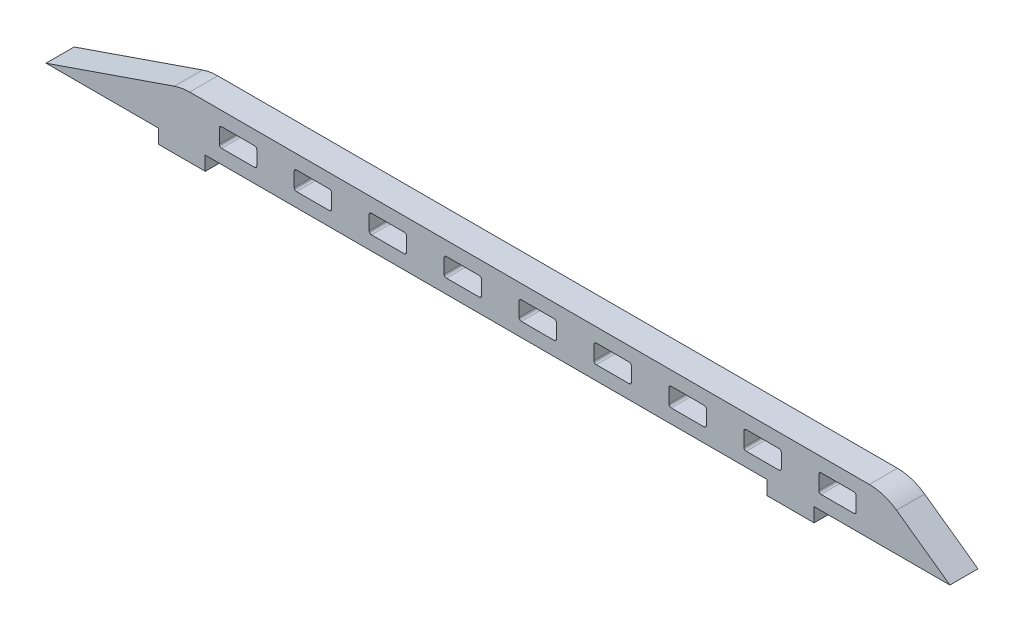
from build123d import *

# Parameters (mm, degrees)
BOSS_EXTRUDE1_DEPTH = 6
FILLET1_R           = 10


with BuildPart() as part:
    # Sketch1 → Boss-Extrude1 (new body)
    with BuildSketch(Plane.XY):
        Polygon((0, 0), (24, 0), (24, -3), (34, -3), (34, 0), (154, 0), (154, -3), (164, -3), (164, 0), (193, 0), (179, 10), (29, 10), align=None)
        with BuildLine():
            Line((53.5, 7), (60.5, 7))
            ThreePointArc((60.5, 7), (60.853553391, 6.853553391), (61, 6.5))
            Line((61, 6.5), (61, 3.5))
            ThreePointArc((61, 3.5), (60.853553391, 3.146446609), (60.5, 3))
            Line((60.5, 3), (53.5, 3))
            ThreePointArc((53.5, 3), (53.146446609, 3.146446609), (53, 3.5))
            Line((53, 3.5), (53, 6.5))
            ThreePointArc((53, 6.5), (53.146446609, 6.853553391), (53.5, 7))
        make_face(mode=Mode.SUBTRACT)
        with BuildLine():
            Line((37.5, 7), (44.5, 7))
            ThreePointArc((44.5, 7), (44.853553391, 6.853553391), (45, 6.5))
            Line((45, 6.5), (45, 3.5))
            ThreePointArc((45, 3.5), (44.853553391, 3.146446609), (44.5, 3))
            Line((44.5, 3), (37.5, 3))
            ThreePointArc((37.5, 3), (37.146446609, 3.146446609), (37, 3.5))
            Line((37, 3.5), (37, 6.5))
            ThreePointArc((37, 6.5), (37.146446609, 6.853553391), (37.5, 7))
        make_face(mode=Mode.SUBTRACT)
        with BuildLine():
            Line((69.5, 7), (76.5, 7))
            ThreePointArc((76.5, 7), (76.853553391, 6.853553391), (77, 6.5))
            Line((77, 6.5), (77, 3.5))
            ThreePointArc((77, 3.5), (76.853553391, 3.146446609), (76.5, 3))
            Line((76.5, 3), (69.5, 3))
            ThreePointArc((69.5, 3), (69.146446609, 3.146446609), (69, 3.5))
            Line((69, 3.5), (69, 6.5))
            ThreePointArc((69, 6.5), (69.146446609, 6.853553391), (69.5, 7))
        make_face(mode=Mode.SUBTRACT)
        with BuildLine():
            Line((85.5, 7), (92.5, 7))
            ThreePointArc((92.5, 7), (92.853553391, 6.853553391), (93, 6.5))
            Line((93, 6.5), (93, 3.5))
            ThreePointArc((93, 3.5), (92.853553391, 3.146446609), (92.5, 3))
            Line((92.5, 3), (85.5, 3))
            ThreePointArc((85.5, 3), (85.146446609, 3.146446609), (85, 3.5))
            Line((85, 3.5), (85, 6.5))
            ThreePointArc((85, 6.5), (85.146446609, 6.853553391), (85.5, 7))
        make_face(mode=Mode.SUBTRACT)
        with BuildLine():
            Line((101.5, 7), (108.5, 7))
            ThreePointArc((108.5, 7), (108.853553391, 6.853553391), (109, 6.5))
            Line((109, 6.5), (109, 3.5))
            ThreePointArc((109, 3.5), (108.853553391, 3.146446609), (108.5, 3))
            Line((108.5, 3), (101.5, 3))
            ThreePointArc((101.5, 3), (101.146446609, 3.146446609), (101, 3.5))
            Line((101, 3.5), (101, 6.5))
            ThreePointArc((101, 6.5), (101.146446609, 6.853553391), (101.5, 7))
        make_face(mode=Mode.SUBTRACT)
        with BuildLine():
            Line((117.5, 7), (124.5, 7))
            ThreePointArc((124.5, 7), (124.853553391, 6.853553391), (125, 6.5))
            Line((125, 6.5), (125, 3.5))
            ThreePointArc((125, 3.5), (124.853553391, 3.146446609), (124.5, 3))
            Line((124.5, 3), (117.5, 3))
            ThreePointArc((117.5, 3), (117.146446609, 3.146446609), (117, 3.5))
            Line((117, 3.5), (117, 6.5))
            ThreePointArc((117, 6.5), (117.146446609, 6.853553391), (117.5, 7))
        make_face(mode=Mode.SUBTRACT)
        with BuildLine():
            Line((133.5, 7), (140.5, 7))
            ThreePointArc((140.5, 7), (140.853553391, 6.853553391), (141, 6.5))
            Line((141, 6.5), (141, 3.5))
            ThreePointArc((141, 3.5), (140.853553391, 3.146446609), (140.5, 3))
            Line((140.5, 3), (133.5, 3))
            ThreePointArc((133.5, 3), (133.146446609, 3.146446609), (133, 3.5))
            Line((133, 3.5), (133, 6.5))
            ThreePointArc((133, 6.5), (133.146446609, 6.853553391), (133.5, 7))
        make_face(mode=Mode.SUBTRACT)
        with BuildLine():
            Line((149.5, 7), (156.5, 7))
            ThreePointArc((156.5, 7), (156.853553391, 6.853553391), (157, 6.5))
            Line((157, 6.5), (157, 3.5))
            ThreePointArc((157, 3.5), (156.853553391, 3.146446609), (156.5, 3))
            Line((156.5, 3), (149.5, 3))
            ThreePointArc((149.5, 3), (149.146446609, 3.146446609), (149, 3.5))
            Line((149, 3.5), (149, 6.5))
            ThreePointArc((149, 6.5), (149.146446609, 6.853553391), (149.5, 7))
        make_face(mode=Mode.SUBTRACT)
        with BuildLine():
            Line((165.5, 7), (172.5, 7))
            ThreePointArc((172.5, 7), (172.853553391, 6.853553391), (173, 6.5))
            Line((173, 6.5), (173, 3.5))
            ThreePointArc((173, 3.5), (172.853553391, 3.146446609), (172.5, 3))
            Line((172.5, 3), (165.5, 3))
            ThreePointArc((165.5, 3), (165.146446609, 3.146446609), (165, 3.5))
            Line((165, 3.5), (165, 6.5))
            ThreePointArc((165, 6.5), (165.146446609, 6.853553391), (165.5, 7))
        make_face(mode=Mode.SUBTRACT)
    extrude(amount=BOSS_EXTRUDE1_DEPTH)

    # Fillet1
    fillet1_edges = [part.edges().sort_by_distance(p)[0] for p in [
        (29, 10, 3),
        (179, 10, 3),
    ]]
    fillet(fillet1_edges, radius=FILLET1_R)


solid = part.part
